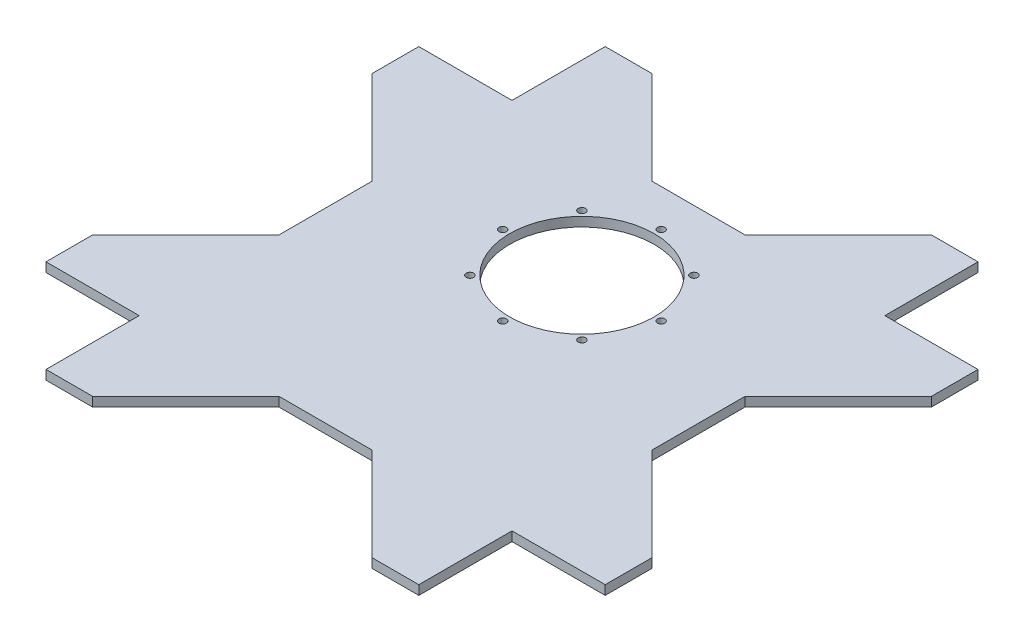
from build123d import *

# Parameters (mm, degrees)
SKETCH_1_W          = 160
SKETCH_1_H          = 160
EXTRUDE_1_DEPTH     = 4
EXTRUDE_2_DEPTH     = 4
SKETCH_3_R          = 31
SKETCH_3_R_2        = 1.6
CUT_EXTRUDE_2_DEPTH = 10


with BuildPart() as part:
    # 草图1 → 凸台-拉伸1 (new body)
    with BuildSketch(Plane(origin=(0, 0, 0), x_dir=(1, 0, 0), z_dir=(0, 1, 0))):
        with Locations((80, 80)):
            Rectangle(SKETCH_1_W, SKETCH_1_H)
    extrude(amount=EXTRUDE_1_DEPTH)

    # 草图2 → 凸台-拉伸2 (add)
    with BuildSketch(Plane(origin=(0, 4, 0), x_dir=(1, 0, 0), z_dir=(0, 1, 0))):
        Polygon((0, 100), (-40, 140), (-40, 160), (0, 160), (0, 200), (20, 200), (60, 160), align=None)
        Polygon((60, 0), (0, 60), (-40, 20), (-40, 0), (0, 0), (0, -40), (20, -40), align=None)
        Polygon((160, 60), (200, 20), (200, 0), (160, 0), (160, -40), (140, -40), (100, 0), align=None)
        Polygon((100, 160), (160, 100), (200, 140), (200, 160), (160, 160), (160, 200), (140, 200), align=None)
    extrude(amount=-EXTRUDE_2_DEPTH)

    # 草图3 → 切除-拉伸2 (cut)
    with BuildSketch(Plane.XZ):
        with Locations(Location((80, -110, 0), (0, 0, 270))):
            Circle(SKETCH_3_R)
        with Locations(Location((80, -76, 0), (0, 0, 270))):
            Circle(SKETCH_3_R_2)
        with Locations(Location((104.04163056, -85.95836944, 0), (0, 0, 270))):
            Circle(SKETCH_3_R_2)
        with Locations(Location((114, -110, 0), (0, 0, 270))):
            Circle(SKETCH_3_R_2)
        with Locations(Location((104.04163056, -134.04163056, 0), (0, 0, 270))):
            Circle(SKETCH_3_R_2)
        with Locations(Location((80, -144, 0), (0, 0, 270))):
            Circle(SKETCH_3_R_2)
        with Locations(Location((55.95836944, -134.04163056, 0), (0, 0, 270))):
            Circle(SKETCH_3_R_2)
        with Locations(Location((46, -110, 0), (0, 0, 270))):
            Circle(SKETCH_3_R_2)
        with Locations(Location((55.95836944, -85.95836944, 0), (0, 0, 270))):
            Circle(SKETCH_3_R_2)
    extrude(amount=-CUT_EXTRUDE_2_DEPTH, mode=Mode.SUBTRACT)


solid = part.part
